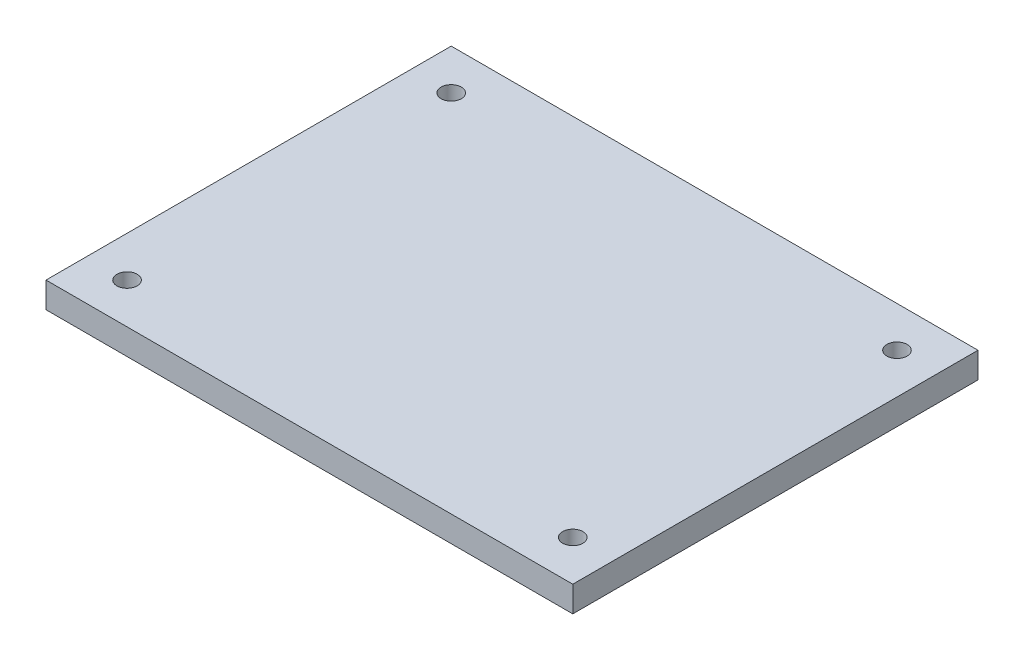
from build123d import *

# Parameters (mm, degrees)
SKETCH1_W                 = 65
SKETCH1_H                 = 50
BOSS_EXTRUDE1_DEPTH       = 3.175
M3X0_5_TAPPED_HOLE1_D     = 2.5
M3X0_5_TAPPED_HOLE1_DEPTH = 7.5
M3X0_5_TAPPED_HOLE1_TIP   = 0.751075774


with BuildPart() as part:
    # Sketch1 → Boss-Extrude1 (new body)
    with BuildSketch(Plane(origin=(0, 0, 0), x_dir=(1, 0, 0), z_dir=(0, 1, 0))):
        with Locations((32.5, 25)):
            Rectangle(SKETCH1_W, SKETCH1_H)
    extrude(amount=BOSS_EXTRUDE1_DEPTH)

    # M3x0.5 Tapped Hole1
    with Locations(Plane(origin=(0, 3.175, 0), x_dir=(-1, 0, 0), z_dir=(0, 1, 0))):
        with Locations((-5, -45), (-60, -45), (-60, -5), (-5, -5)):
            Hole(M3X0_5_TAPPED_HOLE1_D / 2, depth=M3X0_5_TAPPED_HOLE1_DEPTH)
            with Locations((0, 0, -(M3X0_5_TAPPED_HOLE1_DEPTH + M3X0_5_TAPPED_HOLE1_TIP / 2))):  # 118° drill point
                Cone(0, M3X0_5_TAPPED_HOLE1_D / 2, M3X0_5_TAPPED_HOLE1_TIP, mode=Mode.SUBTRACT)


solid = part.part
